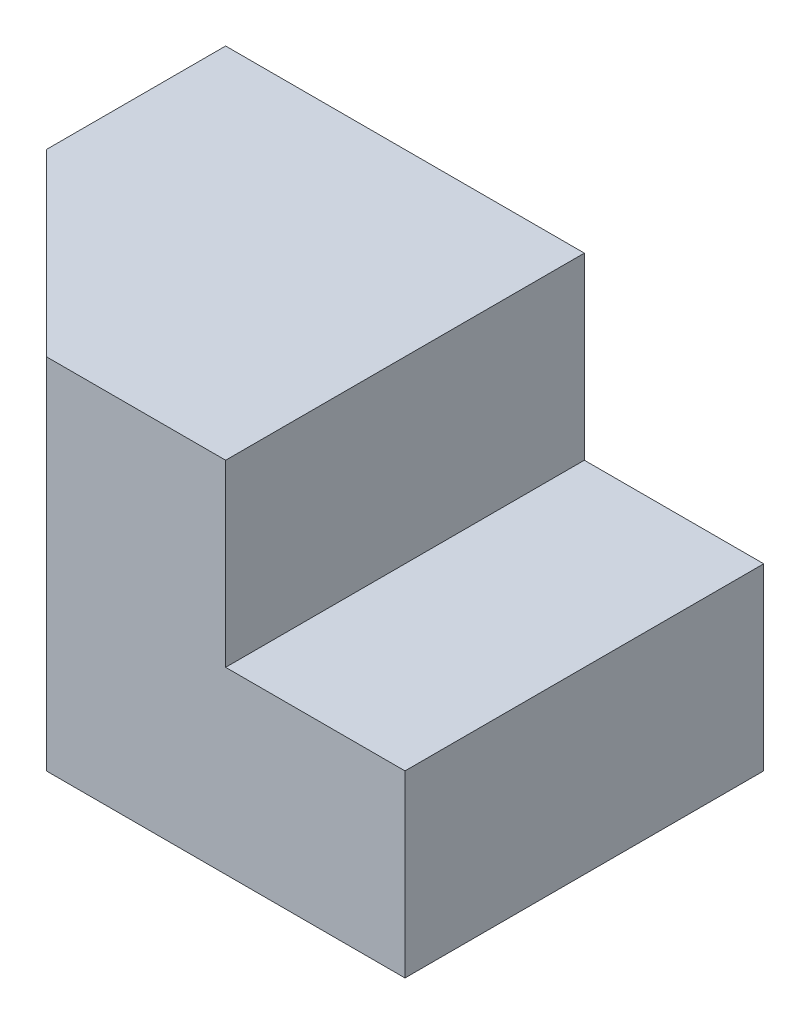
from build123d import *

# Parameters (mm, degrees)
BOSS_EXTRUDE1_DEPTH = 40
CUT_EXTRUDE1_DEPTH  = 40


with BuildPart() as part:
    # Sketch1 → Boss-Extrude1 (new body)
    with BuildSketch(Plane.XY):
        Polygon((-19.095840868, 19.132007233), (-59.095840868, 19.132007233), (-59.095840868, -20.867992767), (0.904159132, -20.867992767), (0.904159132, -0.867992767), (-19.095840868, -0.867992767), align=None)
    extrude(amount=BOSS_EXTRUDE1_DEPTH)

    # Sketch2 → Cut-Extrude1 (cut)
    with BuildSketch(Plane(origin=(0, 19.132007233, 0), x_dir=(1, 0, 0), z_dir=(0, 1, 0))):
        Polygon((-59.095840868, -40), (-39.095840868, -40), (-59.095840868, -20), align=None)
    extrude(amount=-CUT_EXTRUDE1_DEPTH, mode=Mode.SUBTRACT)


solid = part.part
